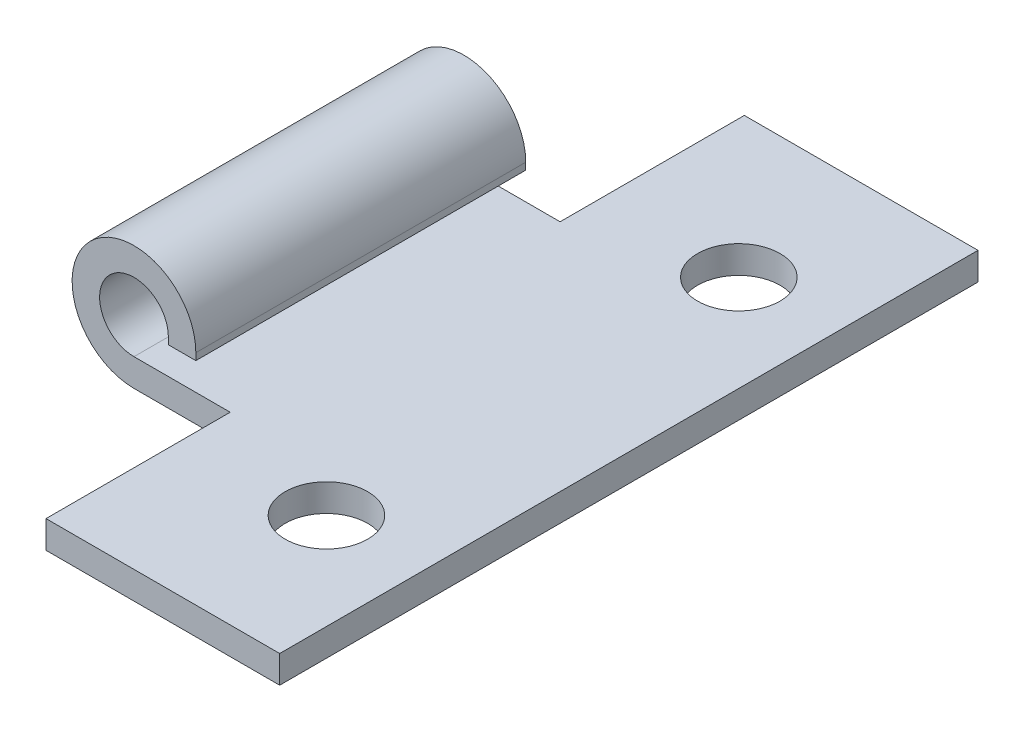
from build123d import *

# Parameters (mm, degrees)
SALIENTE_EXTRUIR1_DEPTH = 25.4
CROQUIS4_R              = 1.5
CROQUIS4_W              = 5.75
CROQUIS4_H              = 6.7
CORTAR_EXTRUIR3_DEPTH   = 29.45013181


with BuildPart() as part:
    # Croquis1 → Saliente-Extruir1 (new body)
    with BuildSketch(Plane.XY):
        with BuildLine():
            Line((0, -2.25), (12, -2.25))
            Line((12, -2.25), (12, -1.25))
            Line((12, -1.25), (1.870828693, -1.25))
            Line((1.870828693, -1.25), (0, -1.25))
            ThreePointArc((0, -1.25), (-0.883883476, 0.883883476), (1.25, 0))
            Line((1.25, 0), (1.25, -0.25))
            Line((1.25, -0.25), (2.236067977, -0.25))
            Line((2.236067977, -0.25), (2.25, -0.25))
            Line((2.25, -0.25), (2.25, 0))
            ThreePointArc((2.25, 0), (-1.590990258, 1.590990258), (0, -2.25))
        make_face()
    extrude(amount=SALIENTE_EXTRUIR1_DEPTH)

    # Croquis4 → Cortar-Extruir3 (cut, through all)
    with BuildSketch(Plane.XZ.offset(2.25)):
        with Locations(Location((8.5, 20.2, 0), (0, 0, 270))):
            Circle(CROQUIS4_R)
        with Locations(Location((8.5, 5.2, 0), (0, 0, 270))):
            Circle(CROQUIS4_R)
        with Locations((0.625, 22.05)):
            Rectangle(CROQUIS4_W, CROQUIS4_H)
        with Locations((0.625, 3.35)):
            Rectangle(CROQUIS4_W, CROQUIS4_H)
    extrude(amount=-CORTAR_EXTRUIR3_DEPTH, mode=Mode.SUBTRACT)


solid = part.part
